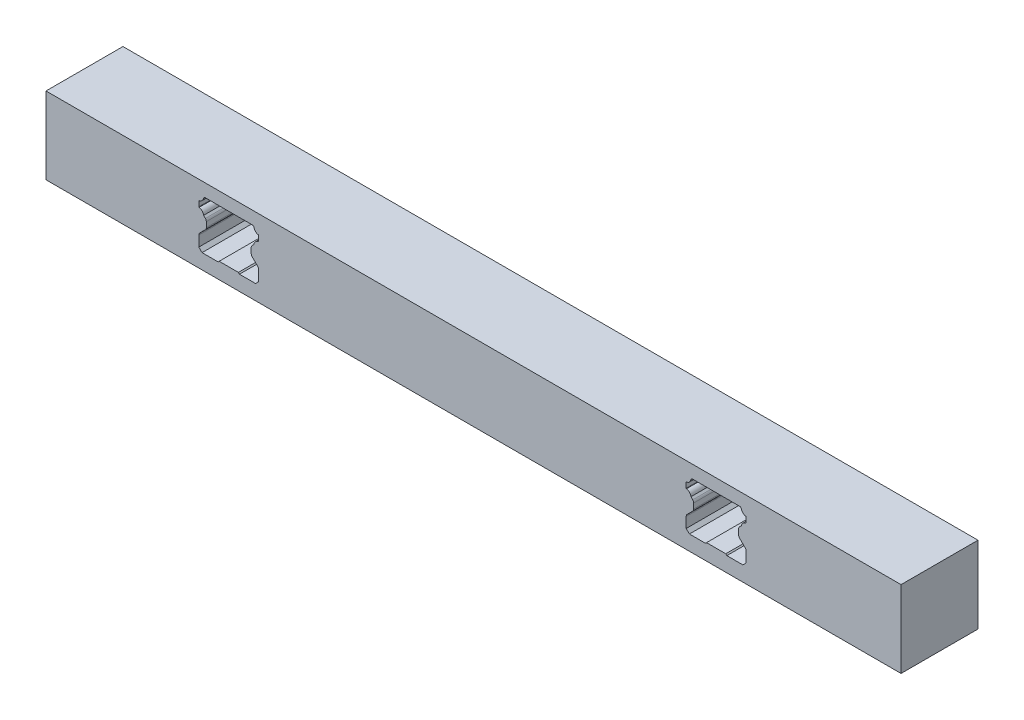
from build123d import *

# Parameters (mm, degrees)
SKETCH_1_W      = 400
SKETCH_1_H      = 36
EXTRUDE_1_DEPTH = 36


with BuildPart() as part:
    # 草图1 → 凸台-拉伸1 (new body)
    with BuildSketch(Plane.XY):
        with Locations((146.804691074, 11.624598534)):
            Rectangle(SKETCH_1_W, SKETCH_1_H)
        with BuildLine():
            Line((18.304691074, 20.776588155), (18.304691074, 18.472608914))
            ThreePointArc((18.304691074, 18.472608914), (18.332858946, 18.345694397), (18.412073037, 18.242612627))
            ThreePointArc((18.412073037, 18.242612627), (19.826614478, 17.527140145), (20.52653516, 16.104839403))
            ThreePointArc((20.52653516, 16.104839403), (20.536242904, 16.093568263), (20.546497421, 16.082792187))
            Line((20.546497421, 16.082792187), (21.365351246, 15.263938362))
            ThreePointArc((21.365351246, 15.263938362), (21.690510372, 14.777303339), (21.804691074, 14.203278191))
            Line((21.804691074, 14.203278191), (21.804691074, 11.745724673))
            ThreePointArc((21.804691074, 11.745724673), (21.690473216, 11.171804017), (21.36535125, 10.685258701))
            Line((21.36535125, 10.685258701), (18.744030902, 8.063938362))
            ThreePointArc((18.744030902, 8.063938362), (18.418871775, 7.577303339), (18.304691074, 7.003278191))
            Line((18.304691074, 7.003278191), (18.304691074, 2.124598534))
            Line((18.304691074, 2.124598534), (19.804691074, 0.624598534))
            Line((19.804691074, 0.624598534), (27.304691074, 0.624598534))
            Line((27.304691074, 0.624598534), (27.804691074, 1.124598534))
            Line((27.804691074, 1.124598534), (36.804691074, 1.124598534))
            Line((36.804691074, 1.124598534), (37.304691074, 0.624598534))
            Line((37.304691074, 0.624598534), (44.804691074, 0.624598534))
            Line((44.804691074, 0.624598534), (46.304691074, 2.124598534))
            Line((46.304691074, 2.124598534), (46.304691074, 7.003472395))
            ThreePointArc((46.304691074, 7.003472395), (46.190473222, 7.577393054), (45.86535125, 8.063938367))
            Line((45.86535125, 8.063938367), (43.244030902, 10.685258706))
            ThreePointArc((43.244030902, 10.685258706), (42.918871775, 11.171893729), (42.804691074, 11.745918878))
            Line((42.804691074, 11.745918878), (42.804691075, 14.203500139))
            ThreePointArc((42.804691075, 14.203500139), (42.91891424, 14.777405867), (43.244030896, 15.263938368))
            Line((43.244030896, 15.263938368), (44.062884727, 16.082792187))
            ThreePointArc((44.062884727, 16.082792187), (44.073139243, 16.093568263), (44.082846988, 16.104839403))
            ThreePointArc((44.082846988, 16.104839403), (44.782767669, 17.527140145), (46.19730911, 18.242612627))
            ThreePointArc((46.19730911, 18.242612627), (46.276523201, 18.345694397), (46.304691074, 18.472608914))
            Line((46.304691074, 18.472608914), (46.304691074, 20.776588155))
            ThreePointArc((46.304691074, 20.776588155), (46.276523201, 20.903502671), (46.19730911, 21.006584442))
            ThreePointArc((46.19730911, 21.006584442), (44.782767669, 21.722056923), (44.082846988, 23.144357665))
            ThreePointArc((44.082846988, 23.144357665), (44.073139243, 23.155628805), (44.062884727, 23.166404881))
            Line((44.062884727, 23.166404881), (43.604691074, 23.624598534))
            Line((43.604691074, 23.624598534), (21.004691074, 23.624598534))
            Line((21.004691074, 23.624598534), (20.546497421, 23.166404881))
            ThreePointArc((20.546497421, 23.166404881), (20.536242905, 23.155628805), (20.52653516, 23.144357665))
            ThreePointArc((20.52653516, 23.144357665), (19.826614478, 21.722056923), (18.412073037, 21.006584442))
            ThreePointArc((18.412073037, 21.006584442), (18.332858946, 20.903502671), (18.304691074, 20.776588155))
        make_face(mode=Mode.SUBTRACT)
        with BuildLine():
            Line((246.304691074, 20.776588155), (246.304691074, 18.472608914))
            ThreePointArc((246.304691074, 18.472608914), (246.332858946, 18.345694397), (246.412073037, 18.242612627))
            ThreePointArc((246.412073037, 18.242612627), (247.826614478, 17.527140145), (248.52653516, 16.104839403))
            ThreePointArc((248.52653516, 16.104839403), (248.536242904, 16.093568263), (248.546497421, 16.082792187))
            Line((248.546497421, 16.082792187), (249.365351245, 15.263938362))
            ThreePointArc((249.365351245, 15.263938362), (249.690510372, 14.777303339), (249.804691074, 14.203278191))
            Line((249.804691074, 14.203278191), (249.804691074, 11.745724673))
            ThreePointArc((249.804691074, 11.745724673), (249.690473216, 11.171804017), (249.36535125, 10.685258701))
            Line((249.36535125, 10.685258701), (246.744030902, 8.063938362))
            ThreePointArc((246.744030902, 8.063938362), (246.418871775, 7.577303339), (246.304691074, 7.003278191))
            Line((246.304691074, 7.003278191), (246.304691074, 2.124598534))
            Line((246.304691074, 2.124598534), (247.804691074, 0.624598534))
            Line((247.804691074, 0.624598534), (255.304691074, 0.624598534))
            Line((255.304691074, 0.624598534), (255.804691074, 1.124598534))
            Line((255.804691074, 1.124598534), (264.804691074, 1.124598534))
            Line((264.804691074, 1.124598534), (265.304691074, 0.624598534))
            Line((265.304691074, 0.624598534), (272.804691074, 0.624598534))
            Line((272.804691074, 0.624598534), (274.304691074, 2.124598534))
            Line((274.304691074, 2.124598534), (274.304691074, 7.003472395))
            ThreePointArc((274.304691074, 7.003472395), (274.190473222, 7.577393054), (273.86535125, 8.063938367))
            Line((273.86535125, 8.063938367), (271.244030902, 10.685258706))
            ThreePointArc((271.244030902, 10.685258706), (270.918871775, 11.171893729), (270.804691074, 11.745918878))
            Line((270.804691074, 11.745918878), (270.804691074, 14.203500139))
            ThreePointArc((270.804691074, 14.203500139), (270.918914239, 14.777405867), (271.244030896, 15.263938368))
            Line((271.244030896, 15.263938368), (272.062884727, 16.082792187))
            ThreePointArc((272.062884727, 16.082792187), (272.073139243, 16.093568263), (272.082846987, 16.104839403))
            ThreePointArc((272.082846987, 16.104839403), (272.782767669, 17.527140145), (274.19730911, 18.242612627))
            ThreePointArc((274.19730911, 18.242612627), (274.276523201, 18.345694397), (274.304691074, 18.472608914))
            Line((274.304691074, 18.472608914), (274.304691074, 20.776588155))
            ThreePointArc((274.304691074, 20.776588155), (274.276523201, 20.903502671), (274.19730911, 21.006584442))
            ThreePointArc((274.19730911, 21.006584442), (272.782767669, 21.722056923), (272.082846987, 23.144357665))
            ThreePointArc((272.082846987, 23.144357665), (272.073139243, 23.155628805), (272.062884727, 23.166404881))
            Line((272.062884727, 23.166404881), (271.604691074, 23.624598534))
            Line((271.604691074, 23.624598534), (249.004691074, 23.624598534))
            Line((249.004691074, 23.624598534), (248.546497421, 23.166404881))
            ThreePointArc((248.546497421, 23.166404881), (248.536242905, 23.155628805), (248.52653516, 23.144357665))
            ThreePointArc((248.52653516, 23.144357665), (247.826614478, 21.722056923), (246.412073037, 21.006584442))
            ThreePointArc((246.412073037, 21.006584442), (246.332858946, 20.903502671), (246.304691074, 20.776588155))
        make_face(mode=Mode.SUBTRACT)
    extrude(amount=EXTRUDE_1_DEPTH)


solid = part.part
